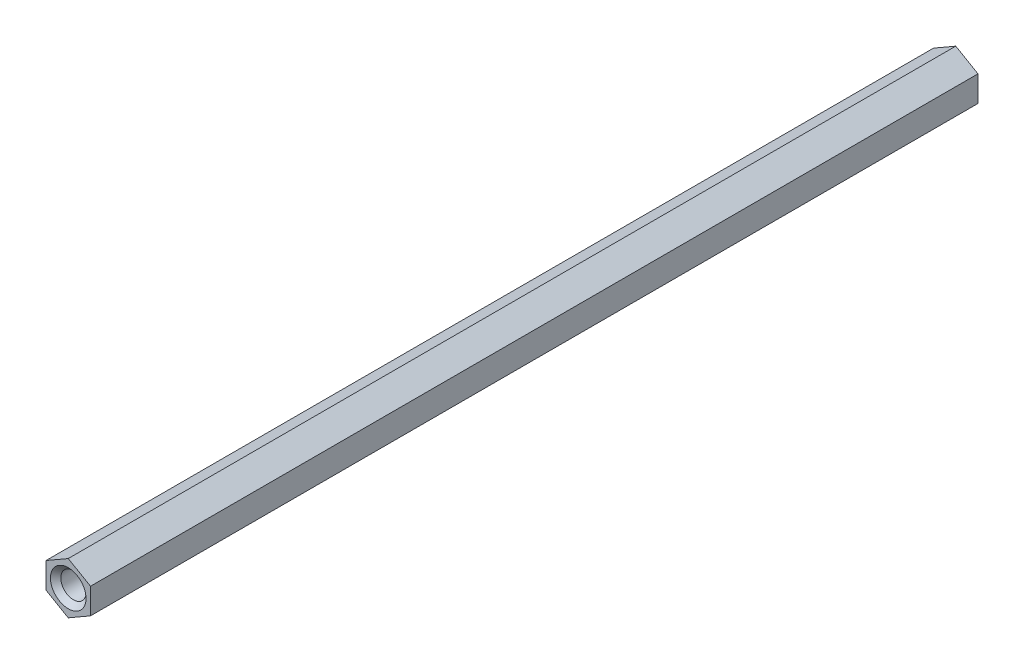
from build123d import *

# Parameters (mm, degrees)
BOSS_EXTRUDE1_DEPTH               = 95
F_1_4_28_TAPPED_HOLE1_D           = 5.4102
F_1_4_28_TAPPED_HOLE1_DEPTH       = 15.24
F_1_4_28_TAPPED_HOLE1_CSINK_D     = 7.62
F_1_4_28_TAPPED_HOLE1_CSINK_ANGLE = 90
F_1_4_28_TAPPED_HOLE1_TIP         = 1.625388061
F_1_4_28_TAPPED_HOLE2_D           = 5.4102
F_1_4_28_TAPPED_HOLE2_DEPTH       = 17.2339
F_1_4_28_TAPPED_HOLE2_CSINK_D     = 7.62
F_1_4_28_TAPPED_HOLE2_CSINK_ANGLE = 90
F_1_4_28_TAPPED_HOLE2_TIP         = 1.625388061


with BuildPart() as part:
    # Sketch3 → Boss-Extrude1 (new, symmetric)
    with BuildSketch(Plane.XY):
        Polygon((0, 5.499261314), (4.7625, 2.749630657), (4.7625, -2.749630657), (0, -5.499261314), (-4.7625, -2.749630657), (-4.7625, 2.749630657), align=None)
    extrude(amount=BOSS_EXTRUDE1_DEPTH, both=True)

    # 1/4-28 Tapped Hole1
    with Locations(Plane.XY.offset(95)):
        with Locations((0, 0)):
            CounterSinkHole(F_1_4_28_TAPPED_HOLE1_D / 2, F_1_4_28_TAPPED_HOLE1_CSINK_D / 2, depth=F_1_4_28_TAPPED_HOLE1_DEPTH, counter_sink_angle=F_1_4_28_TAPPED_HOLE1_CSINK_ANGLE)
            with Locations((0, 0, -(F_1_4_28_TAPPED_HOLE1_DEPTH + F_1_4_28_TAPPED_HOLE1_TIP / 2))):  # 118° drill point
                Cone(0, F_1_4_28_TAPPED_HOLE1_D / 2, F_1_4_28_TAPPED_HOLE1_TIP, mode=Mode.SUBTRACT)

    # 1/4-28 Tapped Hole2
    with Locations(Plane(origin=(0, 0, -95), x_dir=(-1, 0, 0), z_dir=(0, 0, -1))):
        with Locations((0, 0)):
            CounterSinkHole(F_1_4_28_TAPPED_HOLE2_D / 2, F_1_4_28_TAPPED_HOLE2_CSINK_D / 2, depth=F_1_4_28_TAPPED_HOLE2_DEPTH, counter_sink_angle=F_1_4_28_TAPPED_HOLE2_CSINK_ANGLE)
            with Locations((0, 0, -(F_1_4_28_TAPPED_HOLE2_DEPTH + F_1_4_28_TAPPED_HOLE2_TIP / 2))):  # 118° drill point
                Cone(0, F_1_4_28_TAPPED_HOLE2_D / 2, F_1_4_28_TAPPED_HOLE2_TIP, mode=Mode.SUBTRACT)


solid = part.part
